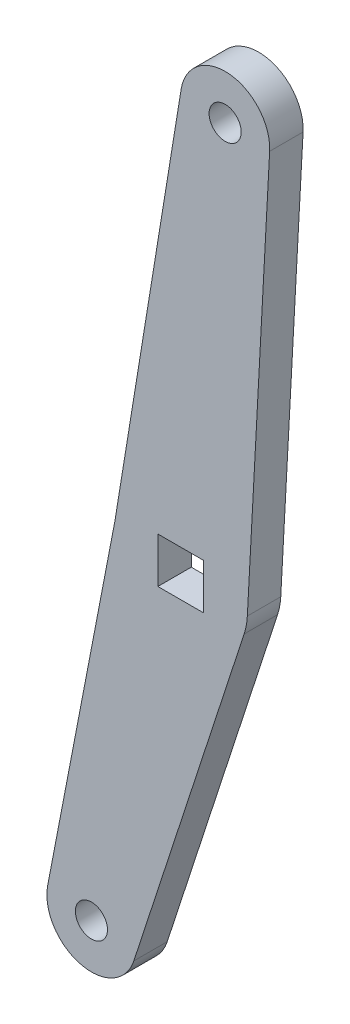
from build123d import *

# Parameters (mm, degrees)
SKETCH1_R           = 2.286
SKETCH1_W           = 6.477
SKETCH1_H           = 6.477
BOSS_EXTRUDE1_DEPTH = 4.7625


with BuildPart() as part:
    # Sketch1 → Boss-Extrude1 (new body)
    with BuildSketch(Plane.XY):
        with BuildLine():
            Line((-6.235543901, 1.200205089), (3.330554168, 50.899898088))
            ThreePointArc((3.330554168, 50.899898088), (3.347215179, 50.989952859), (3.362575674, 51.080238551))
            Line((3.362575674, 51.080238551), (12.782434592, 108.969864627))
            ThreePointArc((12.782434592, 108.969864627), (19.731964071, 114.263273715), (25.390778308, 107.607902862))
            Line((25.390778308, 107.607902862), (22.211167462, 48.67374279))
            ThreePointArc((22.211167462, 48.67374279), (22.06323721, 47.438914255), (21.755683067, 46.233885077))
            Line((21.755683067, 46.233885077), (6.037122044, -1.968668947))
            ThreePointArc((6.037122044, -1.968668947), (-1.587540069, -6.148350716), (-6.235543901, 1.200205089))
        make_face()
        with Locations(Location((0, 0, 0), (0, 0, 180))):
            Circle(SKETCH1_R, mode=Mode.SUBTRACT)
        with Locations(Location((19.05, 107.95, 0), (0, 0, 180))):
            Circle(SKETCH1_R, mode=Mode.SUBTRACT)
        with Locations((12.7, 49.186888497)):
            Rectangle(SKETCH1_W, SKETCH1_H, mode=Mode.SUBTRACT)
    extrude(amount=BOSS_EXTRUDE1_DEPTH)


solid = part.part
